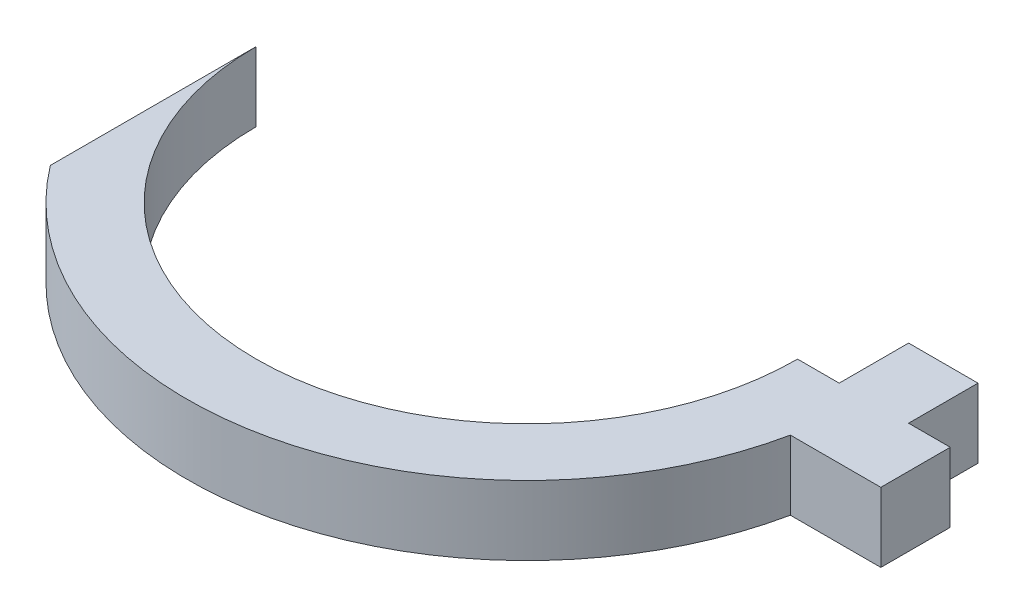
from build123d import *

# Parameters (mm, degrees)
BOSS_EXTRUDE1_DEPTH = 6.35


with BuildPart() as part:
    # Sketch1 → Boss-Extrude1 (new body)
    with BuildSketch(Plane(origin=(0, 0, 0), x_dir=(1, 0, 0), z_dir=(0, 1, 0))):
        with BuildLine():
            Line((-6.35, -6.35), (-6.35, 0))
            Line((-6.35, 0), (0, 0))
            Line((0, 0), (0, -6.35))
            Line((0, -6.35), (3.81, -6.35))
            Line((3.81, -6.35), (3.81, -12.7))
            Line((3.81, -12.7), (-4.464850214, -12.7))
            ThreePointArc((-4.464850214, -12.7), (-28.062720854, -36.698844293), (-59.69, -25.187144157))
            Line((-59.69, -25.187144157), (-59.69, -6.35))
            ThreePointArc((-59.69, -6.35), (-34.925, -31.115), (-10.16, -6.35))
            Line((-10.16, -6.35), (-6.35, -6.35))
        make_face()
    extrude(amount=BOSS_EXTRUDE1_DEPTH)


solid = part.part
